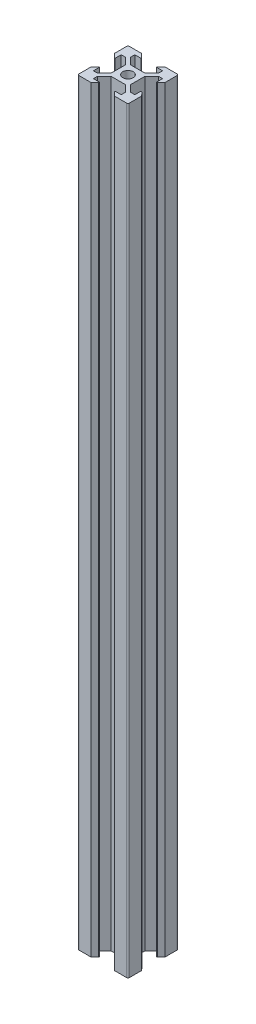
from build123d import *

# Parameters (mm, degrees)
SKETCH1_R           = 2.074585303
BOSS_EXTRUDE2_DEPTH = 300


with BuildPart() as part:
    # Sketch1 → Boss-Extrude2 (new body)
    with BuildSketch(Plane(origin=(0, 0, 0), x_dir=(1, 0, 0), z_dir=(0, 1, 0))):
        with BuildLine():
            Line((6.1, 12.845), (6.1, 7.149086807))
            Line((6.1, 7.149086807), (3.439339828, 4.5))
            Line((3.439339828, 4.5), (1.8, 4.5))
            Line((1.8, 4.5), (1.8, 6.88))
            Line((1.8, 6.88), (1.46, 6.88))
            Line((1.46, 6.88), (0, 5.42))
            Line((0, 5.42), (0, 0.5))
            ThreePointArc((0, 0.5), (0.146446609, 0.146446609), (0.5, 0))
            Line((0.5, 0), (5.42, 0))
            Line((5.42, 0), (6.875, 1.455))
            Line((6.875, 1.455), (6.875, 1.8))
            Line((6.875, 1.8), (4.5, 1.8))
            Line((4.5, 1.8), (4.5, 3.4393348))
            Line((4.5, 3.4393348), (7.158345795, 6.086117297))
            Line((7.158345795, 6.086117297), (7.144523479, 6.1))
            Line((7.144523479, 6.1), (12.854625295, 6.1))
            Line((12.854625295, 6.1), (12.841221344, 6.086548451))
            Line((12.841221344, 6.086548451), (15.499715, 3.437461644))
            Line((15.499715, 3.437461644), (15.5, 3.437747657))
            Line((15.5, 3.437747657), (15.5, 1.8))
            Line((15.5, 1.8), (13.12, 1.8))
            Line((13.12, 1.8), (13.12, 1.455))
            Line((13.12, 1.455), (14.575, 0))
            Line((14.575, 0), (19.5, 0))
            ThreePointArc((19.5, 0), (19.853553391, 0.146446609), (20, 0.5))
            Line((20, 0.5), (20, 5.42))
            Line((20, 5.42), (18.606904708, 6.88))
            Line((18.606904708, 6.88), (18.2, 6.88))
            Line((18.2, 6.88), (18.2, 4.5))
            Line((18.2, 4.5), (16.558493656, 4.5))
            Line((16.558493656, 4.5), (13.9, 7.149086807))
            Line((13.9, 7.149086807), (13.9, 12.844511469))
            Line((13.9, 12.844511469), (16.558493656, 15.492177728))
            Line((16.558493656, 15.492177728), (16.550703242, 15.5))
            Line((16.550703242, 15.5), (18.2, 15.5))
            Line((18.2, 15.5), (18.2, 13.12))
            Line((18.2, 13.12), (18.534428266, 13.12))
            Line((18.534428266, 13.12), (20, 14.58))
            Line((20, 14.58), (20, 19.5))
            ThreePointArc((20, 19.5), (19.853553391, 19.853553391), (19.5, 20))
            Line((19.5, 20), (14.575, 20))
            Line((14.575, 20), (13.12, 18.545))
            Line((13.12, 18.545), (13.12, 18.2))
            Line((13.12, 18.2), (15.5, 18.2))
            Line((15.5, 18.2), (15.5, 16.555))
            Line((15.5, 16.555), (12.834142613, 13.9))
            Line((12.834142613, 13.9), (7.155, 13.9))
            Line((7.155, 13.9), (4.5, 16.555))
            Line((4.5, 16.555), (4.5, 18.2))
            Line((4.5, 18.2), (6.875, 18.2))
            Line((6.875, 18.2), (6.875, 18.545))
            Line((6.875, 18.545), (5.42, 20))
            Line((5.42, 20), (0.5, 20))
            ThreePointArc((0.5, 20), (0.146446609, 19.853553391), (0, 19.5))
            Line((0, 19.5), (0, 14.58))
            Line((0, 14.58), (1.46, 13.12))
            Line((1.46, 13.12), (1.8, 13.12))
            Line((1.8, 13.12), (1.8, 15.5))
            Line((1.8, 15.5), (3.445, 15.5))
            Line((3.445, 15.5), (3.439339828, 15.494339828))
            Line((3.439339828, 15.494339828), (6.094339828, 12.839339828))
            Line((6.094339828, 12.839339828), (6.1, 12.845))
        make_face()
        with Locations(Location((10, 10, 0), (0, 0, 270))):
            Circle(SKETCH1_R, mode=Mode.SUBTRACT)
    extrude(amount=BOSS_EXTRUDE2_DEPTH)


solid = part.part
